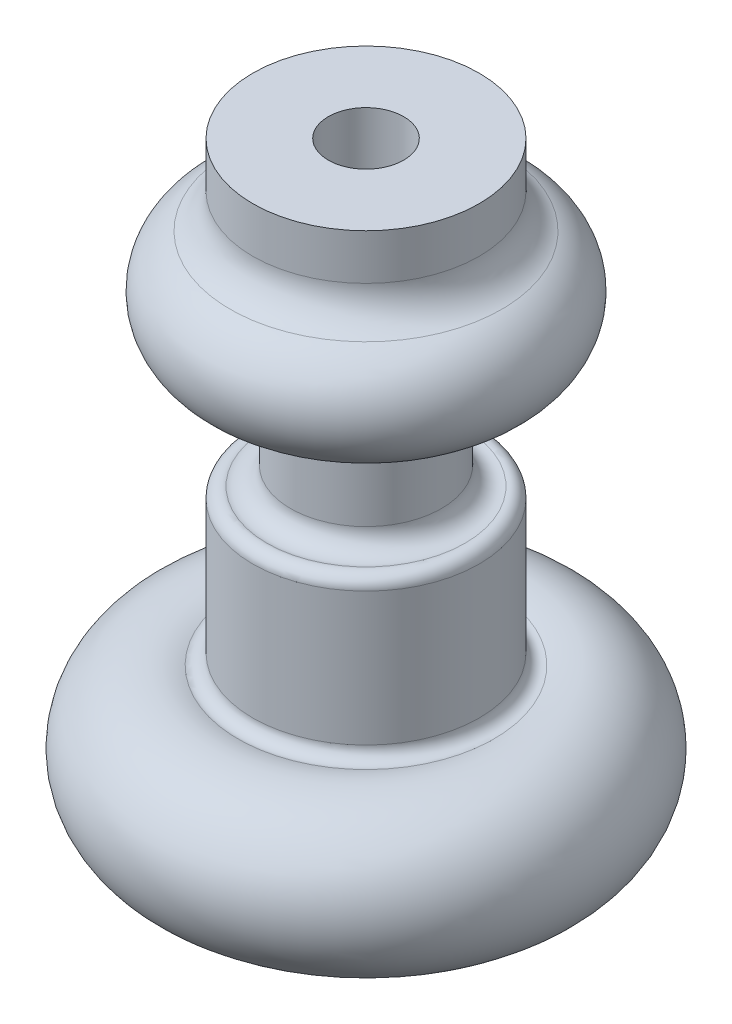
from build123d import *


with BuildPart() as part:
    # Sketch1 → Revolve1 (revolve)
    with BuildSketch(Plane.XY, mode=Mode.PRIVATE) as revolve1_sk:
        with BuildLine():
            Line((0, 0), (40, 0))
            ThreePointArc((40, 0), (59.761381377, 23.080228252), (33.913043478, 39.051219391))
            ThreePointArc((33.913043478, 39.051219391), (31.230696526, 39.486183741), (30, 41.9089023))
            Line((30, 41.9089023), (30, 77.254033308))
            ThreePointArc((30, 77.254033308), (28.837117307, 79.625741553), (26.25, 80.158770817))
            ThreePointArc((26.25, 80.158770817), (21.938137822, 81.047152925), (20, 85))
            Line((20, 85), (20, 100))
            ThreePointArc((20, 100), (22.928932188, 107.071067812), (30, 110))
            ThreePointArc((30, 110), (44.683594694, 121.935355345), (36, 138.747727085))
            ThreePointArc((36, 138.747727085), (31.633399735, 142.4356529), (30, 147.912878475))
            Line((30, 147.912878475), (30, 160))
            Line((30, 160), (10, 160))
            Line((10, 160), (10, 120))
            Line((10, 120), (0, 120))
            Line((0, 120), (0, 0))
        make_face()
    revolve(revolve1_sk.sketch.rotate(Axis((0, 0, 0), (0, 1, 0)), 90), axis=Axis((0, 0, 0), (0, 1, 0)))


solid = part.part
